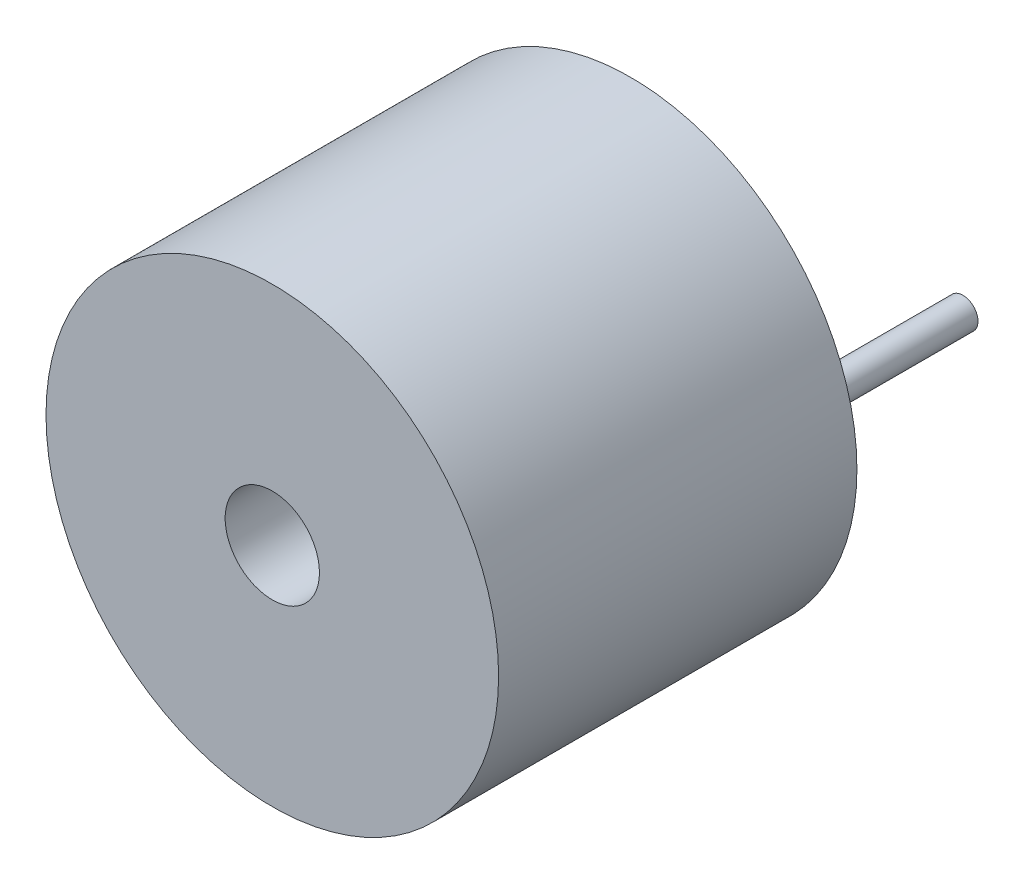
from build123d import *

# Parameters (mm, degrees)
SKETCH_1_R          = 6
EXTRUDE_1_DEPTH     = 9.5
SKETCH_2_R          = 0.4
EXTRUDE_2_DEPTH     = 5
SKETCH_3_R          = 1.25
CUT_EXTRUDE_1_DEPTH = 5


with BuildPart() as part:
    # 草图1 → 拉伸1 (new body)
    with BuildSketch(Plane.XY):
        Circle(SKETCH_1_R)
    extrude(amount=EXTRUDE_1_DEPTH)

    # 草图2 → 拉伸2 (add)
    with BuildSketch(Plane(origin=(0, 0, 0), x_dir=(-1, 0, 0), z_dir=(0, 0, -1))):
        with Locations(Location((-3.81, 0, 0), (0, 0, 180))):
            Circle(SKETCH_2_R)
        with Locations(Location((3.81, 0, 0), (0, 0, 180))):
            Circle(SKETCH_2_R)
    extrude(amount=EXTRUDE_2_DEPTH)

    # 草图3 → 切除-拉伸1 (cut)
    with BuildSketch(Plane.XY.offset(9.5)):
        Circle(SKETCH_3_R)
    extrude(amount=-CUT_EXTRUDE_1_DEPTH, mode=Mode.SUBTRACT)


solid = part.part
